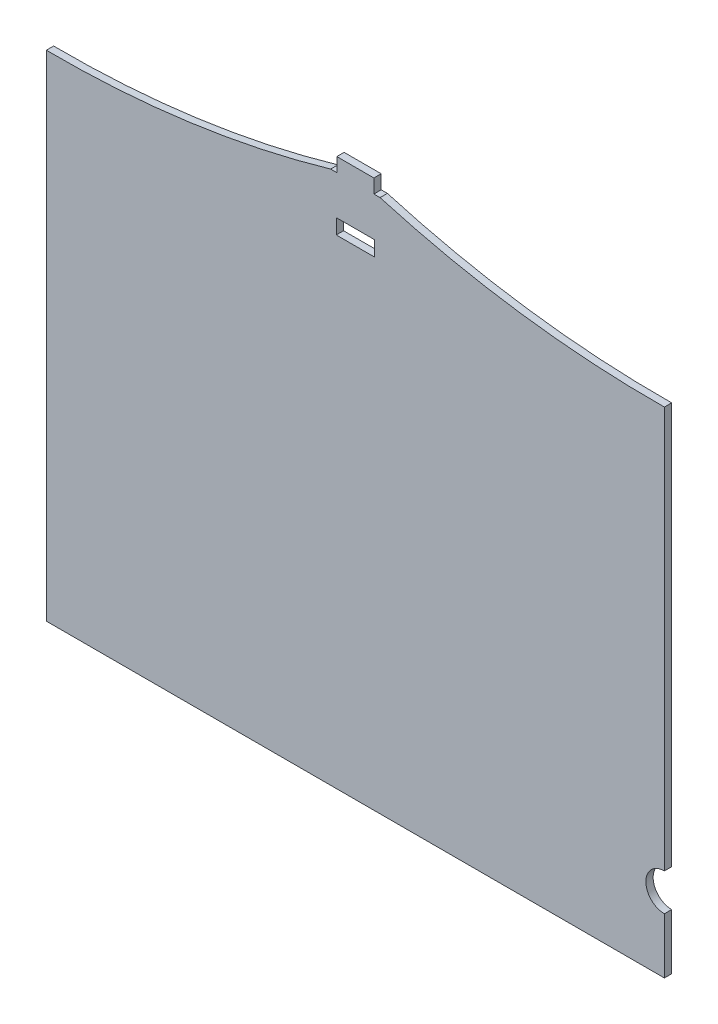
from build123d import *

# Parameters (mm, degrees)
SKETCH1_W           = 15.45
SKETCH1_H           = 6.08
BOSS_EXTRUDE1_DEPTH = 2.95


with BuildPart() as part:
    # Sketch1 → Boss-Extrude1 (new body)
    with BuildSketch(Plane.XY):
        with BuildLine():
            Line((0.171167624, 69.469671818), (2.671167624, 69.469671818))
            Line((2.671167624, 69.469671818), (2.671167624, 75.099671818))
            Line((2.671167624, 75.099671818), (17.671167624, 75.099671818))
            Line((17.671167624, 75.099671818), (17.671167624, 69.469671818))
            Line((17.671167624, 69.469671818), (20.171167624, 69.469671818))
            ThreePointArc((20.171167624, 69.469671818), (77.092371221, 57.340494982), (135.171167624, 53.599671818))
            Line((135.171167624, 53.599671818), (135.171167624, -108.900328182))
            ThreePointArc((135.171167624, -108.900328182), (127.671167624, -116.400328182), (135.171167624, -123.900328182))
            Line((135.171167624, -123.900328182), (135.171167624, -146.400328182))
            Line((135.171167624, -146.400328182), (-114.828832376, -146.400328182))
            Line((-114.828832376, -146.400328182), (-114.828832376, 53.599671818))
            ThreePointArc((-114.828832376, 53.599671818), (-56.750035973, 57.340494982), (0.171167624, 69.469671818))
        make_face()
        with Locations((10.171167624, 50.559671818)):
            Rectangle(SKETCH1_W, SKETCH1_H, mode=Mode.SUBTRACT)
    extrude(amount=BOSS_EXTRUDE1_DEPTH)


solid = part.part
